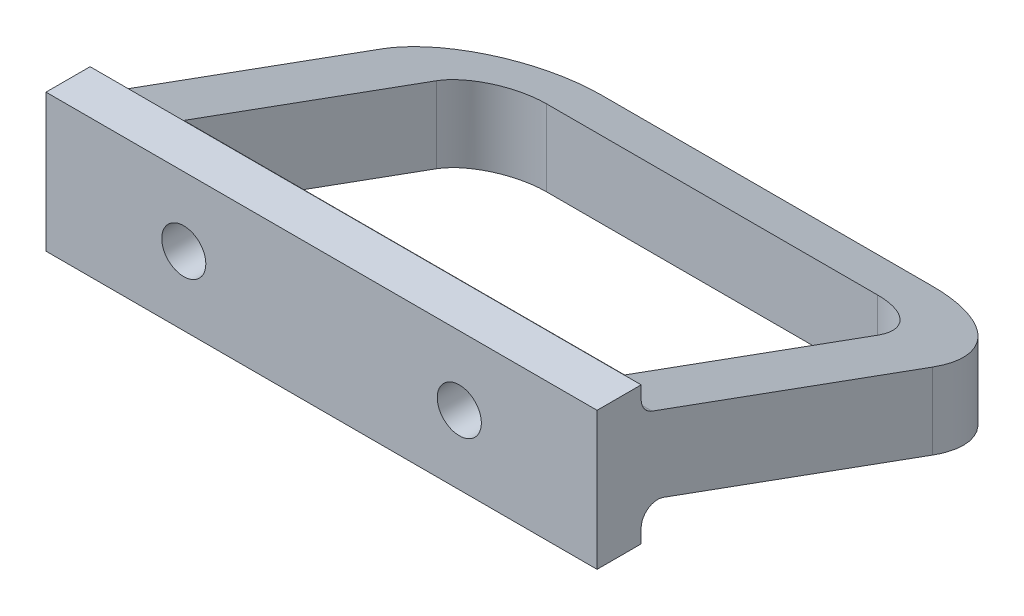
from build123d import *

# Parameters (mm, degrees)
BOSS_EXTRUDE1_DEPTH = 100
CUT_EXTRUDE3_REACH  = 138.159
FILLET2_R           = 20
SKETCH6_R           = 4
CUT_EXTRUDE4_DEPTH  = 15


with BuildPart() as part:
    # Sketch1 → Boss-Extrude1 (new body)
    with BuildSketch(Plane.YZ):
        with BuildLine():
            Line((-12.5, 0), (-12.5, -8))
            Line((-12.5, -8), (-10.019077862, -8))
            ThreePointArc((-10.019077862, -8), (-7.561621729, -9.279270691), (-7.2, -12.02606043))
            Line((-7.2, -12.02606043), (-32.25, -80.850369787))
            Line((-32.25, -80.850369787), (-18.415688958, -80.850369787))
            Line((-18.415688958, -80.850369787), (7.381221952, -9.97393957))
            ThreePointArc((7.381221952, -9.97393957), (8.479570506, -8.542543867), (10.200299815, -8))
            Line((10.200299815, -8), (12.5, -8))
            Line((12.5, -8), (12.5, 0))
            Line((12.5, 0), (-12.5, 0))
        make_face()
    extrude(amount=-BOSS_EXTRUDE1_DEPTH)

    # Cut-Extrude3: up to this plane
    cut_extrude3_end = Plane(origin=(-100, -7.2, -12.02606043), z_dir=(0, -0.9396926207859074, 0.34202014332567165))
    # Sketch5 → Cut-Extrude3 (cut, up to the surface)
    with BuildSketch(Plane(origin=(0, 12.5, 0), x_dir=(-1, 0, 0), z_dir=(0, 1, 0)), mode=Mode.PRIVATE) as cut_extrude3_sk1:
        with BuildLine():
            Line((10, -15), (10, -60.850369787))
            ThreePointArc((10, -60.850369787), (12.928932188, -67.921437599), (20, -70.850369787))
            Line((20, -70.850369787), (80, -70.850369787))
            ThreePointArc((80, -70.850369787), (87.071067812, -67.921437599), (90, -60.850369787))
            Line((90, -60.850369787), (90, -15))
            Line((90, -15), (10, -15))
        make_face()
    cut_extrude3_tool1 = split(extrude(cut_extrude3_sk1.sketch, amount=-CUT_EXTRUDE3_REACH, mode=Mode.PRIVATE), bisect_by=cut_extrude3_end, keep=Keep.BOTH, mode=Mode.PRIVATE)
    add(cut_extrude3_tool1.solids().sort_by_distance((-50, 12.5, -42.675996))[0], mode=Mode.SUBTRACT)

    # Fillet2
    fillet2_edges = [part.edges().sort_by_distance(p)[0] for p in [
        (0, -25.332844479, -80.850369787),
        (-100, -25.332844479, -80.850369787),
    ]]
    fillet(fillet2_edges, radius=FILLET2_R)

    # Sketch6 → Cut-Extrude4 (cut)
    with BuildSketch(Plane.XY):
        with Locations((-75, 0)):
            Circle(SKETCH6_R)
        with Locations((-25, 0)):
            Circle(SKETCH6_R)
    extrude(amount=-CUT_EXTRUDE4_DEPTH, mode=Mode.SUBTRACT)


solid = part.part
